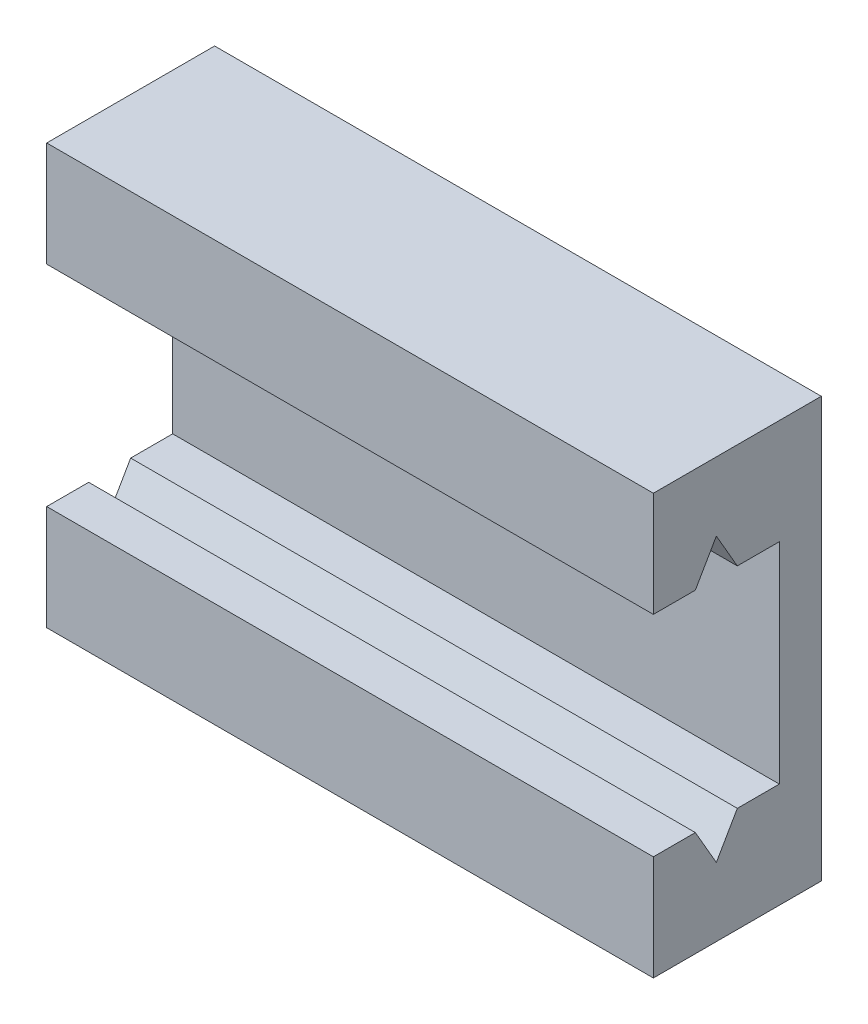
from build123d import *

# Parameters (mm, degrees)
SKETCH_1_W          = 28.9
SKETCH_1_H          = 20
EXTRUDE_1_DEPTH     = 8
CUT_EXTRUDE_9_REACH = 38.045
SKETCH_2_R          = 1.5
CUT_EXTRUDE_1_DEPTH = 4


with BuildPart() as part:
    # 草图1 → 凸台-拉伸1 (new body)
    with BuildSketch(Plane.XY):
        with Locations((14.45, 10)):
            Rectangle(SKETCH_1_W, SKETCH_1_H)
    extrude(amount=EXTRUDE_1_DEPTH)

    # 草图3 → 切除-拉伸9 (cut, up to next)
    with BuildSketch(Plane(origin=(28.9, 0, 0), x_dir=(0, 0, -1), z_dir=(1, 0, 0)), mode=Mode.PRIVATE) as cut_extrude_9_sk1:
        Polygon((-8, 15), (-6, 15), (-5, 16.732050808), (-4, 15), (-2, 15), (-2, 5), (-4, 5), (-5, 3.267949192), (-6, 5), (-8, 5), align=None)
    cut_extrude_9_tool1 = extrude(cut_extrude_9_sk1.sketch, amount=-CUT_EXTRUDE_9_REACH, mode=Mode.PRIVATE) & part.part
    add(cut_extrude_9_tool1.solids().sort_by_distance((28.9, 10, 5))[0], mode=Mode.SUBTRACT)

    # 草图2 → 切除-拉伸1 (cut)
    with BuildSketch(Plane(origin=(0, 0, 0), x_dir=(-1, 0, 0), z_dir=(0, 0, -1))):
        with Locations((-19.45, 17.5)):
            Circle(SKETCH_2_R)
        with Locations((-9.45, 17.5)):
            Circle(SKETCH_2_R)
        with Locations((-19.45, 2.5)):
            Circle(SKETCH_2_R)
        with Locations((-9.45, 2.5)):
            Circle(SKETCH_2_R)
    extrude(amount=-CUT_EXTRUDE_1_DEPTH, mode=Mode.SUBTRACT)


solid = part.part
